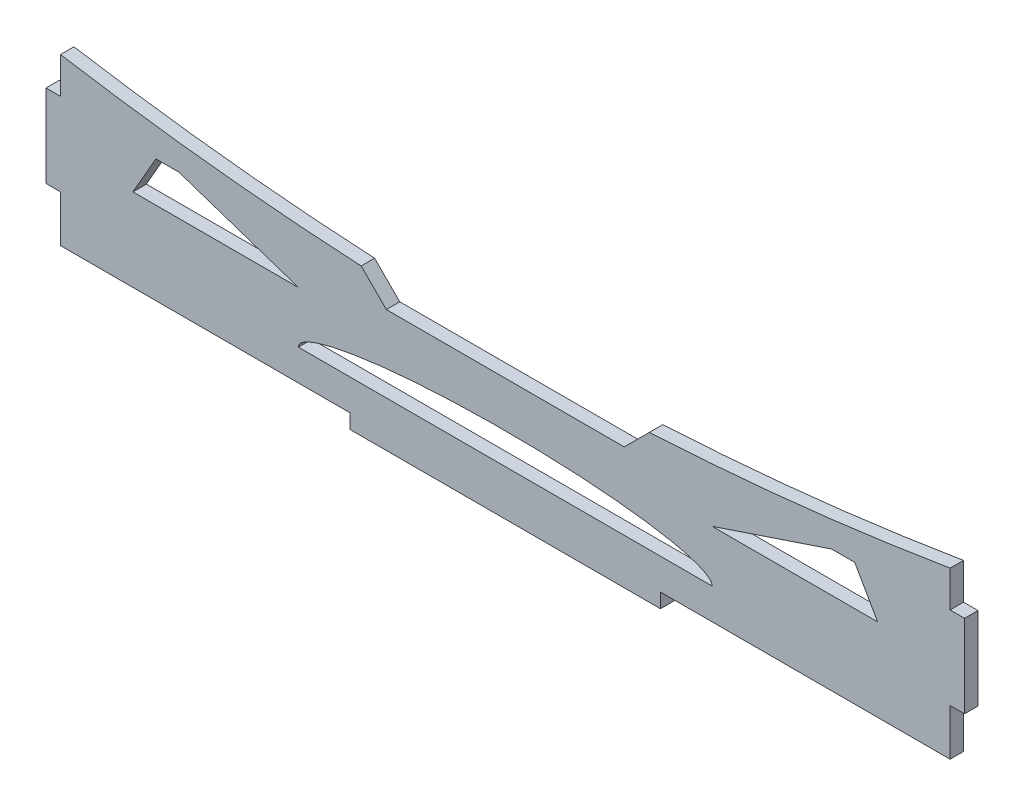
from build123d import *

# Parameters (mm, degrees)
SKETCH1_W           = 86
SKETCH1_H           = 16
BOSS_EXTRUDE1_DEPTH = 1.3
SKETCH2_W           = 1.4
SKETCH2_H           = 8
SKETCH2_W_2         = 30
SKETCH2_H_2         = 1.4
BOSS_EXTRUDE2_DEPTH = 1.3
CUT_EXTRUDE1_DEPTH  = 46.40275322
CUT_EXTRUDE2_DEPTH  = 46.40275322


with BuildPart() as part:
    # Sketch1 → Boss-Extrude1 (new body)
    with BuildSketch(Plane.XY):
        Rectangle(SKETCH1_W, SKETCH1_H)
    extrude(amount=BOSS_EXTRUDE1_DEPTH)

    # Sketch2 → Boss-Extrude2 (add)
    with BuildSketch(Plane.XY.offset(1.3)):
        with Locations((-43.7, 0.5)):
            Rectangle(SKETCH2_W, SKETCH2_H)
        with Locations((43.7, 0.5)):
            Rectangle(SKETCH2_W, SKETCH2_H)
        with Locations((0, -8.7)):
            Rectangle(SKETCH2_W_2, SKETCH2_H_2)
    extrude(amount=-BOSS_EXTRUDE2_DEPTH)

    # Sketch3 → Cut-Extrude1 (cut, through all)
    with BuildSketch(Plane.XY.offset(1.3)):
        with BuildLine():
            Line((-43, 8), (43, 8))
            ThreePointArc((43, 8), (0, 4.461913504), (-43, 8))
        make_face()
        Polygon((-20, 0), (-31.555732492, 3.872025984), (-33.777866246, 3.872025984), (-36, 0), align=None)
        Polygon((36, 0), (20, 0), (31.555732492, 3.872025984), (33.777866246, 3.872025984), align=None)
    extrude(amount=-CUT_EXTRUDE1_DEPTH, mode=Mode.SUBTRACT)

    # Sketch4 → Cut-Extrude2 (cut, through all)
    with BuildSketch(Plane.XY.offset(1.3)):
        Polygon((-13.931038069, 4.831038069), (-11.5, 2.4), (11.5, 2.4), (13.931038069, 4.831038069), align=None)
        with BuildLine():
            Line((-20, -5), (20, -5))
            add(Edge.make_bspline(
                [(20, -5), (20, -2), (0, -2), (-20, -2), (-20, -5)],
                knots=[0, 0, 0, 1.570796327, 1.570796327, 3.141592654, 3.141592654, 3.141592654], degree=2, weights=[1, 0.707106781, 1, 0.707106781, 1]))
        make_face()
    extrude(amount=-CUT_EXTRUDE2_DEPTH, mode=Mode.SUBTRACT)


solid = part.part
